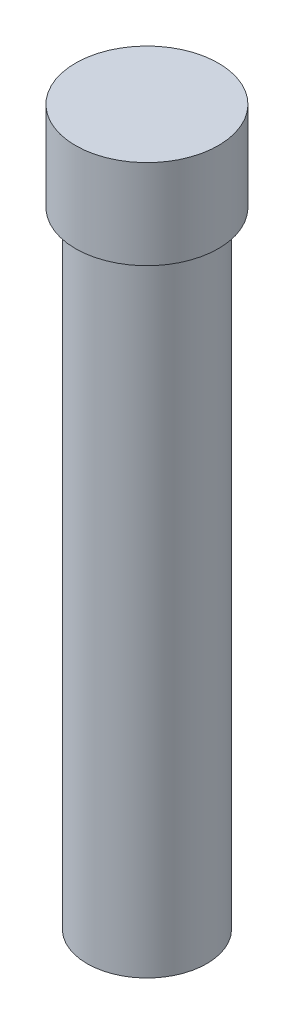
from build123d import *

# Parameters (mm, degrees)
SKETCH_1_R      = 3.35
EXTRUDE_1_DEPTH = 35
SKETCH_2_R      = 4
EXTRUDE_2_DEPTH = 5


with BuildPart() as part:
    # 草图1 → 凸台-拉伸1 (new body)
    with BuildSketch(Plane(origin=(0, 0, 0), x_dir=(1, 0, 0), z_dir=(0, 1, 0))):
        with Locations(Location((0, 0, 0), (0, 0, 270))):
            Circle(SKETCH_1_R)
    extrude(amount=EXTRUDE_1_DEPTH)

    # 草图2 → 凸台-拉伸2 (add)
    with BuildSketch(Plane(origin=(0, 35, 0), x_dir=(1, 0, 0), z_dir=(0, 1, 0))):
        with Locations(Location((0, 0, 0), (0, 0, 270))):
            Circle(SKETCH_2_R)
    extrude(amount=EXTRUDE_2_DEPTH)


solid = part.part
